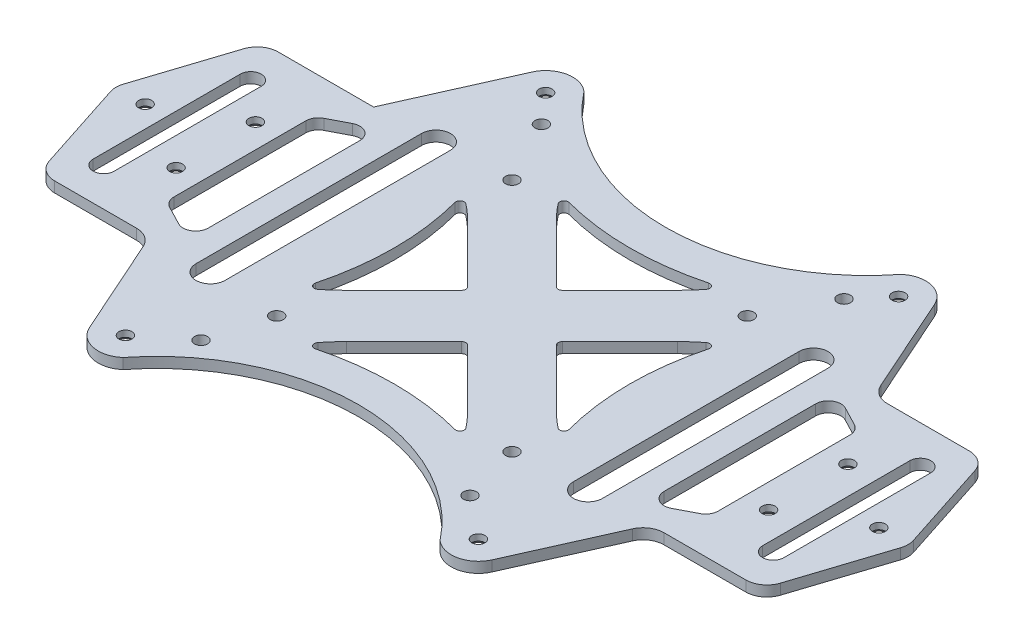
from build123d import *

# Parameters (mm, degrees)
SKETCH_1_R             = 1.55
EXTRUDE_1_DEPTH        = 2.5
CHAMFER_2_SIZE         = 1
CUT_EXTRUDE_4745_DEPTH = 111.115546384
FILLET_2_R             = 3
FILLET_3_R             = 5
FILLET_4_R             = 1


with BuildPart() as part:
    # 草图1 → 凸台-拉伸1 (new body)
    with BuildSketch(Plane(origin=(0, 0, 0), x_dir=(1, 0, 0), z_dir=(0, 1, 0))):
        with BuildLine():
            Line((47.899982554, 52.633397656), (59.52497064, 26.588251477))
            Line((59.52497064, 26.588251477), (85.869588061, 26.588251477))
            Line((85.869588061, 26.588251477), (94.505759306, 0))
            Line((94.505759306, 0), (85.869588061, -26.588251477))
            Line((85.869588061, -26.588251477), (59.52497064, -26.588251477))
            Line((59.52497064, -26.588251477), (47.899982554, -52.633397656))
            ThreePointArc((47.899982554, -52.633397656), (43.362068791, -56.315801292), (37.709796983, -54.831018053))
            ThreePointArc((37.709796983, -54.831018053), (0, -36.529018179), (-37.709796983, -54.831018053))
            ThreePointArc((-37.709796983, -54.831018053), (-43.362068791, -56.315801292), (-47.899982554, -52.633397656))
            Line((-47.899982554, -52.633397656), (-59.52497064, -26.588251477))
            Line((-59.52497064, -26.588251477), (-85.869588061, -26.588251477))
            Line((-85.869588061, -26.588251477), (-94.505759306, 0))
            Line((-94.505759306, 0), (-85.869588061, 26.588251477))
            Line((-85.869588061, 26.588251477), (-59.52497064, 26.588251477))
            Line((-59.52497064, 26.588251477), (-47.899982554, 52.633397656))
            ThreePointArc((-47.899982554, 52.633397656), (-43.362068791, 56.315801292), (-37.709796983, 54.831018053))
            ThreePointArc((-37.709796983, 54.831018053), (0, 36.529018179), (37.709796983, 54.831018053))
            ThreePointArc((37.709796983, 54.831018053), (43.362068791, 56.315801292), (47.899982554, 52.633397656))
        make_face()
        with Locations(Location((42, 50, 0), (0, 0, 270))):
            Circle(SKETCH_1_R, mode=Mode.SUBTRACT)
        with Locations(Location((42, -50, 0), (0, 0, 90))):
            Circle(SKETCH_1_R, mode=Mode.SUBTRACT)
        with Locations(Location((-42, -50, 0), (0, 0, 270))):
            Circle(SKETCH_1_R, mode=Mode.SUBTRACT)
        with Locations(Location((-42, 50, 0), (0, 0, 90))):
            Circle(SKETCH_1_R, mode=Mode.SUBTRACT)
        with Locations(Location((36, 43, 0), (0, 0, 270))):
            Circle(SKETCH_1_R, mode=Mode.SUBTRACT)
        with Locations(Location((32, -42, 0), (0, 0, 270))):
            Circle(SKETCH_1_R, mode=Mode.SUBTRACT)
        with Locations(Location((-32, -42, 0), (0, 0, 90))):
            Circle(SKETCH_1_R, mode=Mode.SUBTRACT)
        with Locations(Location((-36, 43, 0), (0, 0, 90))):
            Circle(SKETCH_1_R, mode=Mode.SUBTRACT)
        with Locations(Location((70.5, 9.435839055, 0), (0, 0, 270))):
            Circle(SKETCH_1_R, mode=Mode.SUBTRACT)
        with Locations(Location((70.5, -9.435839055, 0), (0, 0, 90))):
            Circle(SKETCH_1_R, mode=Mode.SUBTRACT)
        with Locations(Location((-70.5, -9.435839055, 0), (0, 0, 270))):
            Circle(SKETCH_1_R, mode=Mode.SUBTRACT)
        with Locations(Location((-70.5, 9.435839055, 0), (0, 0, 90))):
            Circle(SKETCH_1_R, mode=Mode.SUBTRACT)
        with Locations(Location((87.3, 0, 0), (0, 0, 270))):
            Circle(SKETCH_1_R, mode=Mode.SUBTRACT)
        with Locations(Location((-87.3, 0, 0), (0, 0, 90))):
            Circle(SKETCH_1_R, mode=Mode.SUBTRACT)
        with Locations(Location((28, 28, 0), (0, 0, 270))):
            Circle(SKETCH_1_R, mode=Mode.SUBTRACT)
        with Locations(Location((28, -28, 0), (0, 0, 270))):
            Circle(SKETCH_1_R, mode=Mode.SUBTRACT)
        with Locations(Location((-28, -28, 0), (0, 0, 270))):
            Circle(SKETCH_1_R, mode=Mode.SUBTRACT)
        with Locations(Location((-28, 28, 0), (0, 0, 270))):
            Circle(SKETCH_1_R, mode=Mode.SUBTRACT)
        with BuildLine():
            Line((77.169642998, -17.5), (77.169642998, 17.5))
            ThreePointArc((77.169642998, 17.5), (79.669642998, 20), (82.169642998, 17.5))
            Line((82.169642998, 17.5), (82.169642998, -17.5))
            ThreePointArc((82.169642998, -17.5), (79.669642998, -20), (77.169642998, -17.5))
        make_face(mode=Mode.SUBTRACT)
        with BuildLine():
            Line((-77.169642998, -17.5), (-77.169642998, 17.5))
            ThreePointArc((-77.169642998, 17.5), (-79.669642998, 20), (-82.169642998, 17.5))
            Line((-82.169642998, 17.5), (-82.169642998, -17.5))
            ThreePointArc((-82.169642998, -17.5), (-79.669642998, -20), (-77.169642998, -17.5))
        make_face(mode=Mode.SUBTRACT)
        with BuildLine():
            Line((-24.995975583, 14.429581723), (-10.56639386, 0))
            Line((-10.56639386, 0), (-24.995975583, -14.429581723))
            ThreePointArc((-24.995975583, -14.429581723), (-27.869597938, -17.042325553), (-30.978168019, -19.370614155))
            ThreePointArc((-30.978168019, -19.370614155), (-28.024295248, 0), (-30.978168019, 19.370614155))
            ThreePointArc((-30.978168019, 19.370614155), (-27.869597938, 17.042325553), (-24.995975583, 14.429581723))
        make_face(mode=Mode.SUBTRACT)
        with BuildLine():
            Line((14.429581723, 24.995975583), (0, 10.56639386))
            Line((0, 10.56639386), (-14.429581723, 24.995975583))
            ThreePointArc((-14.429581723, 24.995975583), (-17.042325553, 27.869597938), (-19.370614155, 30.978168019))
            ThreePointArc((-19.370614155, 30.978168019), (0, 28.024295248), (19.370614155, 30.978168019))
            ThreePointArc((19.370614155, 30.978168019), (17.042325553, 27.869597938), (14.429581723, 24.995975583))
        make_face(mode=Mode.SUBTRACT)
        with BuildLine():
            Line((24.995975583, -14.429581723), (10.56639386, 0))
            Line((10.56639386, 0), (24.995975583, 14.429581723))
            ThreePointArc((24.995975583, 14.429581723), (27.869597938, 17.042325553), (30.978168019, 19.370614155))
            ThreePointArc((30.978168019, 19.370614155), (28.024295248, 0), (30.978168019, -19.370614155))
            ThreePointArc((30.978168019, -19.370614155), (27.869597938, -17.042325553), (24.995975583, -14.429581723))
        make_face(mode=Mode.SUBTRACT)
        with BuildLine():
            Line((-14.429581723, -24.995975583), (0, -10.56639386))
            Line((0, -10.56639386), (14.429581723, -24.995975583))
            ThreePointArc((14.429581723, -24.995975583), (17.042325553, -27.869597938), (19.370614155, -30.978168019))
            ThreePointArc((19.370614155, -30.978168019), (0, -28.024295248), (-19.370614155, -30.978168019))
            ThreePointArc((-19.370614155, -30.978168019), (-17.042325553, -27.869597938), (-14.429581723, -24.995975583))
        make_face(mode=Mode.SUBTRACT)
        with BuildLine():
            Line((41.468701347, -26.829343455), (41.468701347, 26.829343455))
            ThreePointArc((41.468701347, 26.829343455), (44.919200659, 30.279842767), (48.36969997, 26.829343455))
            Line((48.36969997, 26.829343455), (48.36969997, -26.829343455))
            ThreePointArc((48.36969997, -26.829343455), (44.919200659, -30.279842767), (41.468701347, -26.829343455))
        make_face(mode=Mode.SUBTRACT)
        with BuildLine():
            Line((-41.468701347, -26.829343455), (-41.468701347, 26.829343455))
            ThreePointArc((-41.468701347, 26.829343455), (-44.919200659, 30.279842767), (-48.36969997, 26.829343455))
            Line((-48.36969997, 26.829343455), (-48.36969997, -26.829343455))
            ThreePointArc((-48.36969997, -26.829343455), (-44.919200659, -30.279842767), (-41.468701347, -26.829343455))
        make_face(mode=Mode.SUBTRACT)
    extrude(amount=EXTRUDE_1_DEPTH)

    # 倒角2
    chamfer_2_edges = [part.edges().sort_by_distance(p)[0] for p in [
        (70.5, 0, 10.985839055),
        (-70.5, 0, 7.885839055),
        (70.5, 0, -10.985839055),
        (-70.5, 0, -7.885839055),
        (87.3, 0, -1.55),
        (-87.3, 0, 1.55),
        (-42, 0, 48.45),
        (-42, 0, -48.45),
        (42, 0, -51.55),
        (42, 0, 51.55),
    ]]
    chamfer(chamfer_2_edges, length=CHAMFER_2_SIZE)

    # Sketch 4500 → Cut-Extrude 4745 (cut, through all)
    with BuildSketch(Plane.XZ):
        Polygon((-64.75, 17.5), (-54.25, 22.965954031), (-54.25, -22.965954031), (-64.75, -17.5), align=None)
        Polygon((54.25, -22.965954031), (64.75, -17.5), (64.75, 17.5), (54.25, 22.965954031), align=None)
    extrude(amount=-CUT_EXTRUDE_4745_DEPTH, mode=Mode.SUBTRACT)

    # 圆角2
    fillet_2_edges = [part.edges().sort_by_distance(p)[0] for p in [
        (-64.75, 1.25, -17.5),
        (-64.75, 1.25, 17.5),
        (-54.25, 1.25, 22.965954031),
        (-54.25, 1.25, -22.965954031),
        (54.25, 1.25, -22.965954031),
        (54.25, 1.25, 22.965954031),
        (64.75, 1.25, 17.5),
        (64.75, 1.25, -17.5),
    ]]
    fillet(fillet_2_edges, radius=FILLET_2_R)

    # 圆角3
    fillet_3_edges = [part.edges().sort_by_distance(p)[0] for p in [
        (59.52497064, 1.25, -26.588251477),
        (85.869588061, 1.25, -26.588251477),
        (94.505759306, 1.25, 0),
        (85.869588061, 1.25, 26.588251477),
        (59.52497064, 1.25, 26.588251477),
        (-59.52497064, 1.25, 26.588251477),
        (-85.869588061, 1.25, 26.588251477),
        (-94.505759306, 1.25, 0),
        (-85.869588061, 1.25, -26.588251477),
    ]]
    fillet(fillet_3_edges, radius=FILLET_3_R)

    # 圆角4
    fillet_4_edges = [part.edges().sort_by_distance(p)[0] for p in [
        (-30.978168019, 1.25, -19.370614155),
        (-30.978168019, 1.25, 19.370614155),
        (-10.56639386, 1.25, 0),
        (30.978168019, 1.25, 19.370614155),
        (30.978168019, 1.25, -19.370614155),
        (10.56639386, 1.25, 0),
        (-19.370614155, 1.25, 30.978168019),
        (19.370614155, 1.25, 30.978168019),
        (0, 1.25, 10.56639386),
        (19.370614155, 1.25, -30.978168019),
        (-19.370614155, 1.25, -30.978168019),
        (0, 1.25, -10.56639386),
    ]]
    fillet(fillet_4_edges, radius=FILLET_4_R)


solid = part.part
